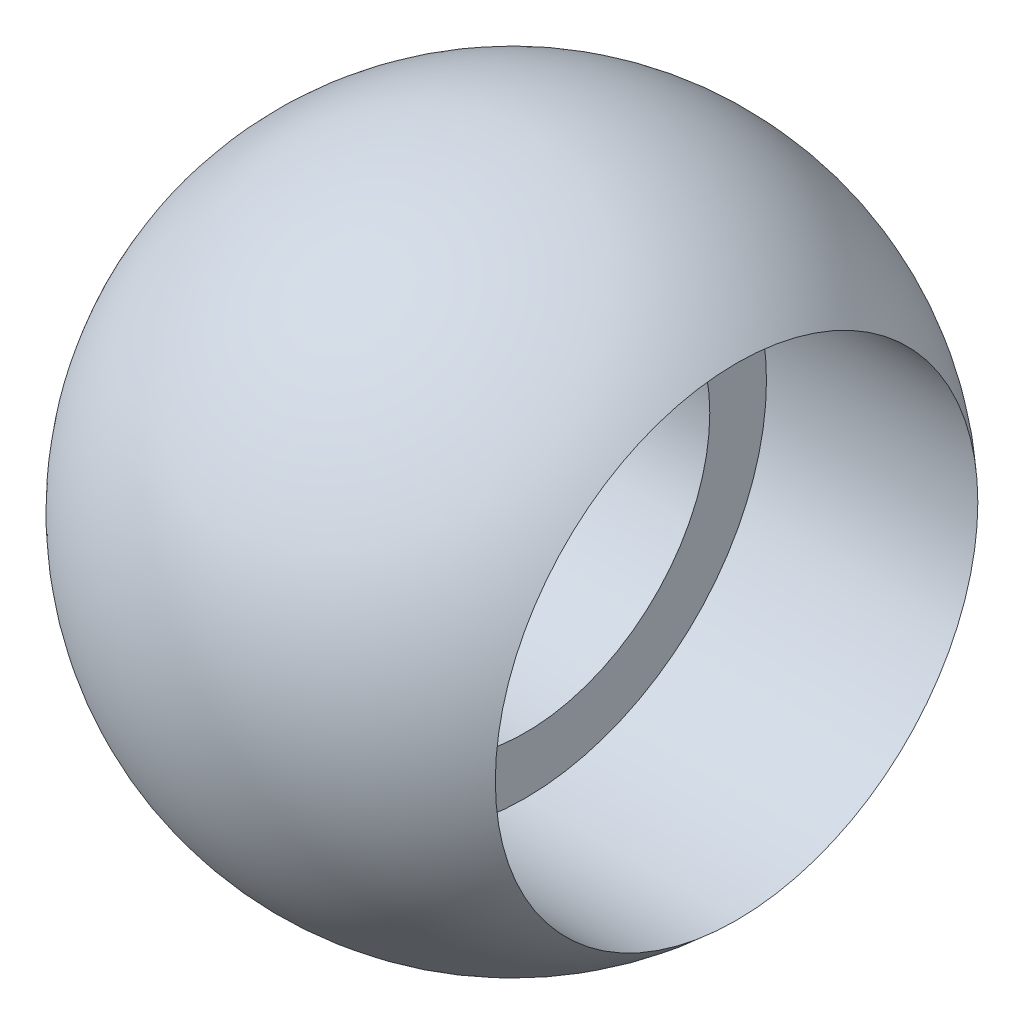
from build123d import *

# Parameters (mm, degrees)
SKETCH2_R          = 1.778
CUT_EXTRUDE1_DEPTH = 8.777129933
SKETCH3_R          = 2.3241
CUT_EXTRUDE2_DEPTH = 3.048


with BuildPart() as part:
    # Sketch1 → Revolve3 (revolve)
    with BuildSketch(Plane(origin=(0, 0, 0), x_dir=(1, 0, 0), z_dir=(0, 1, 0))):
        with BuildLine():
            Line((0, 3.175), (0, -3.175))
            ThreePointArc((0, -3.175), (3.175, 0), (0, 3.175))
        make_face()
    revolve(axis=Axis((0, 0, -3.175), (0, 0, 1)))

    # Sketch2 → Cut-Extrude1 (cut, through all)
    with BuildSketch(Plane(origin=(3.175, 0, 0), x_dir=(0, 0, -1), z_dir=(1, 0, 0))):
        Circle(SKETCH2_R)
    extrude(amount=-CUT_EXTRUDE1_DEPTH, mode=Mode.SUBTRACT)

    # Sketch3 → Cut-Extrude2 (cut)
    with BuildSketch(Plane(origin=(3.175, 0, 0), x_dir=(0, 0, -1), z_dir=(1, 0, 0))):
        Circle(SKETCH3_R)
    extrude(amount=-CUT_EXTRUDE2_DEPTH, mode=Mode.SUBTRACT)


solid = part.part
